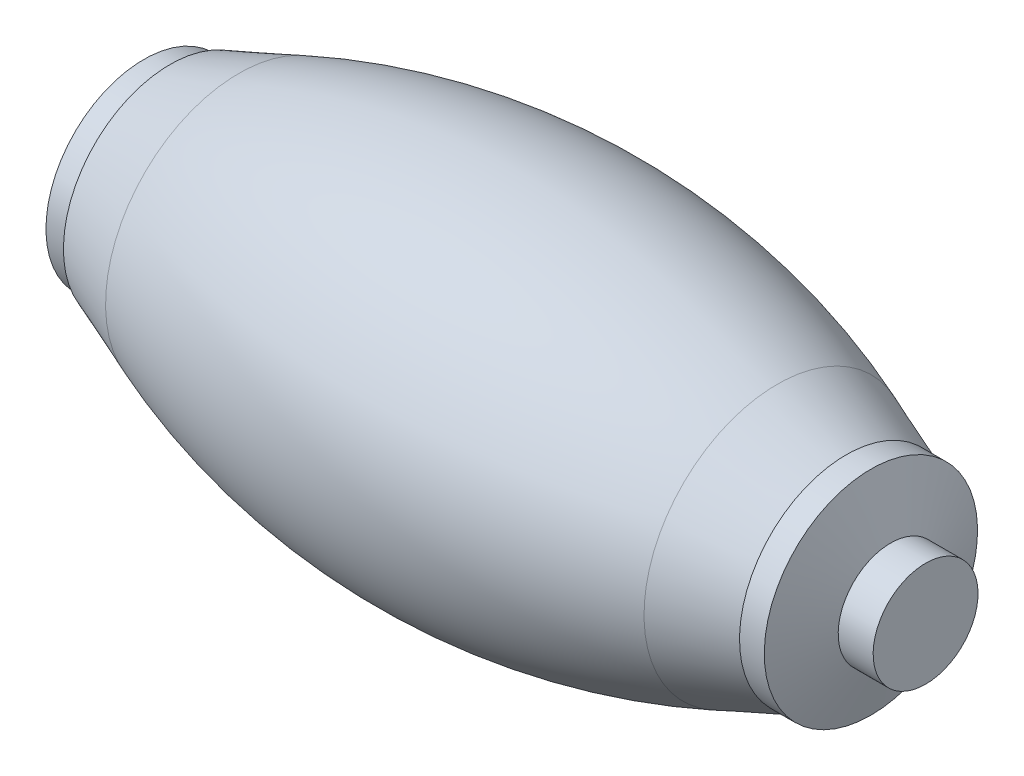
from build123d import *


with BuildPart() as part:
    # Sketch1 → Revolve1 (revolve)
    with BuildSketch(Plane.XY, mode=Mode.PRIVATE) as revolve1_sk:
        with BuildLine():
            Line((-142, 35.56), (-132.475, 35.56))
            Line((-132.475, 35.56), (-132.475, 38.735))
            Line((-132.475, 38.735), (-107.475, 48.431888695))
            ThreePointArc((-107.475, 48.431888695), (-9.669877031, 66.73566879), (88.135245938, 48.431888695))
            Line((88.135245938, 48.431888695), (113.135245938, 38.735))
            Line((113.135245938, 38.735), (122.135245938, 38.735))
            Line((122.135245938, 38.735), (129.3, 19.05))
            Line((129.3, 19.05), (142, 19.05))
            Line((142, 19.05), (142, 0))
            Line((142, 0), (-142, 0))
            Line((-142, 0), (-142, 35.56))
        make_face()
    revolve(revolve1_sk.sketch.rotate(Axis((142, 0, 0), (1, 0, 0)), 180), axis=Axis((142, 0, 0), (1, 0, 0)))


solid = part.part
